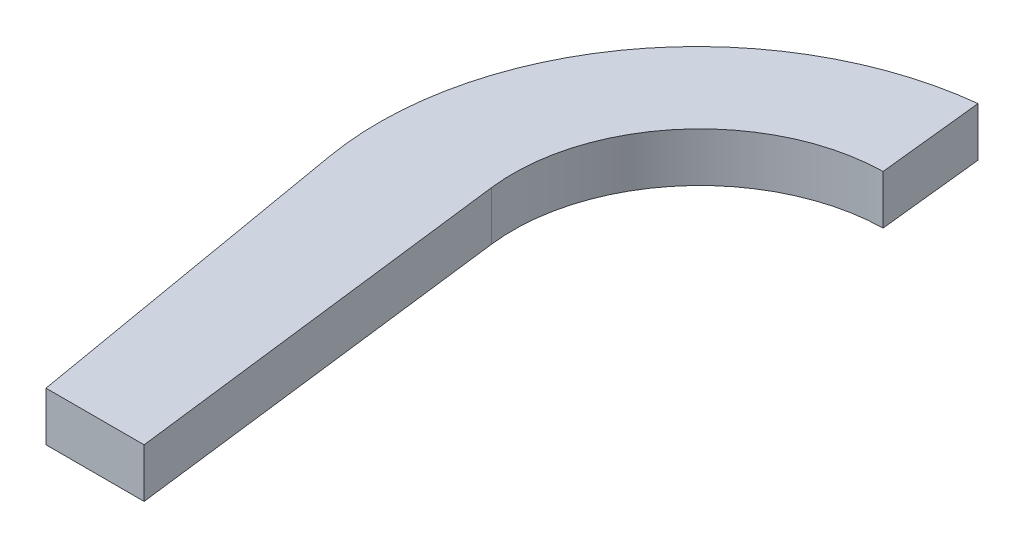
from build123d import *

# Parameters (mm, degrees)
BOSS_EXTRUDE1_DEPTH = 19.05


with BuildPart() as part:
    # Sketch1 → Boss-Extrude1 (new body)
    with BuildSketch(Plane(origin=(0, 0, 0), x_dir=(1, 0, 0), z_dir=(0, 1, 0))):
        with BuildLine():
            Line((-19.05, 0), (19.05, 0))
            Line((19.05, 0), (0, 153.946752773))
            ThreePointArc((0, 153.946752773), (17.1781045, 210.379807697), (70.596720949, 235.404363218))
            Line((70.596720949, 235.404363218), (66.190957042, 276.659357883))
            ThreePointArc((66.190957042, 276.659357883), (-18.919063667, 228.193574854), (-41.950158875, 132.997900565))
            Line((-41.950158875, 132.997900565), (-19.05, 0))
        make_face()
    extrude(amount=BOSS_EXTRUDE1_DEPTH)


solid = part.part
